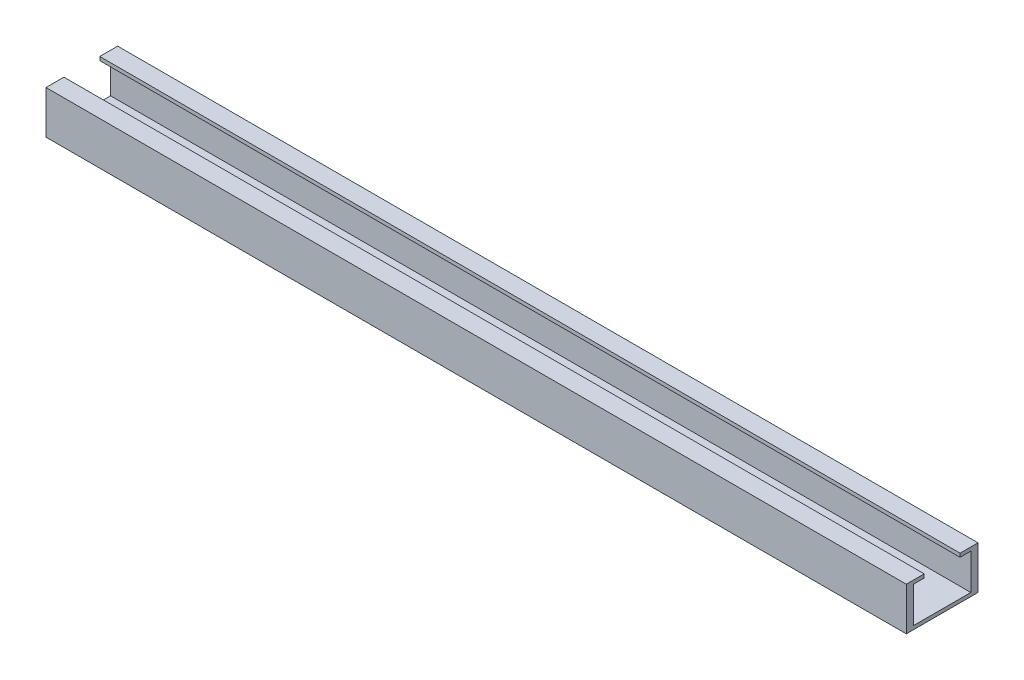
from build123d import *

# Parameters (mm, degrees)
SKETCH1_W           = 600
SKETCH1_H           = 50
BOSS_EXTRUDE1_DEPTH = 30
SKETCH2_W           = 40
SKETCH2_H           = 25
CUT_EXTRUDE1_DEPTH  = 602.62290577
SKETCH3_W           = 600
SKETCH3_H           = 25
CUT_EXTRUDE2_DEPTH  = 20


with BuildPart() as part:
    # Sketch1 → Boss-Extrude1 (new body)
    with BuildSketch(Plane(origin=(0, 0, 0), x_dir=(1, 0, 0), z_dir=(0, 1, 0))):
        with Locations((20.477137177, 7.4055666)):
            Rectangle(SKETCH1_W, SKETCH1_H)
    extrude(amount=BOSS_EXTRUDE1_DEPTH)

    # Sketch2 → Cut-Extrude1 (cut, through all)
    with BuildSketch(Plane.ZY.offset(279.522862823)):
        with Locations((-7.4055666, 15)):
            Rectangle(SKETCH2_W, SKETCH2_H)
    extrude(amount=-CUT_EXTRUDE1_DEPTH, mode=Mode.SUBTRACT)

    # Sketch3 → Cut-Extrude2 (cut)
    with BuildSketch(Plane(origin=(0, 30, 0), x_dir=(1, 0, 0), z_dir=(0, 1, 0))):
        with Locations((20.477137177, 7.4055666)):
            Rectangle(SKETCH3_W, SKETCH3_H)
    extrude(amount=-CUT_EXTRUDE2_DEPTH, mode=Mode.SUBTRACT)


solid = part.part
